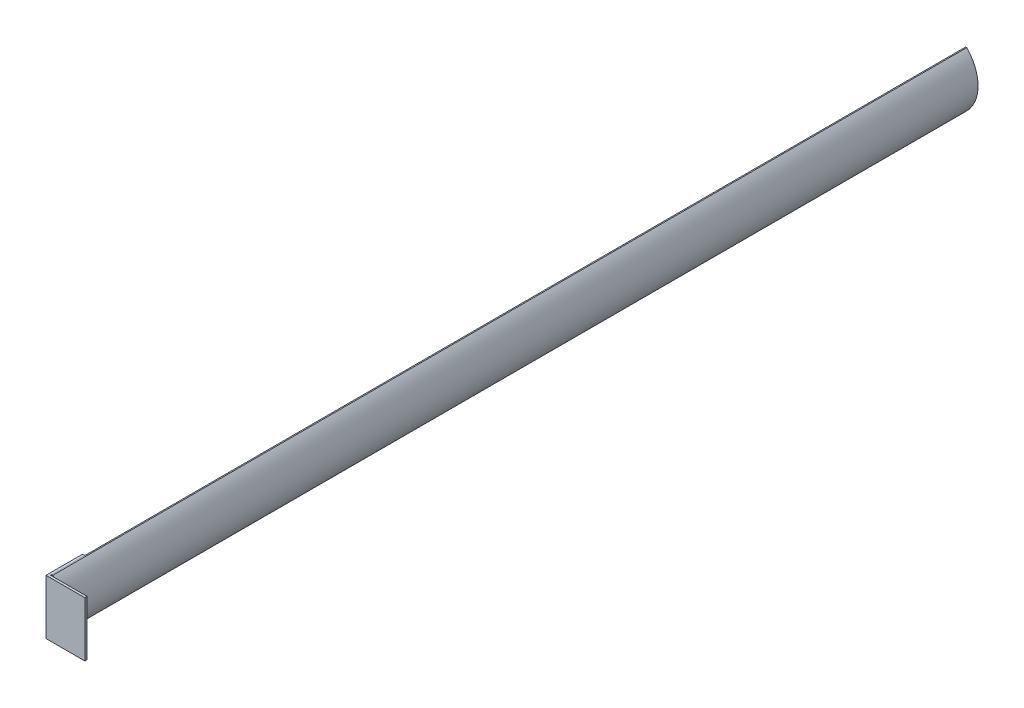
from build123d import *

# Parameters (mm, degrees)
SALIENTE_EXTRUIR1_DEPTH = 400
SALIENTE_EXTRUIR6_DEPTH = 24


with BuildPart() as part:
    # Croquis1 → Saliente-Extruir1 (new body)
    with BuildSketch(Plane.XY):
        with BuildLine():
            Line((0, 0), (-0.5, 0))
            ThreePointArc((-0.5, 0), (4.470562748, -12), (-0.5, -24))
            Line((-0.5, -24), (0, -24))
            ThreePointArc((0, -24), (4.970562748, -12), (0, 0))
        make_face()
    extrude(amount=SALIENTE_EXTRUIR1_DEPTH)


with BuildPart() as body_2:
    # Croquis2 → Saliente-Extruir6 (new body)
    with BuildSketch(Plane(origin=(0, 0, 0), x_dir=(1, 0, 0), z_dir=(0, 1, 0))):
        Polygon((-1.5, -385.5), (-0.5, -385.5), (-0.5, -400.5), (15.5, -400.5), (15.5, -401.5), (-1.5, -401.5), align=None)
    extrude(amount=-SALIENTE_EXTRUIR6_DEPTH)


solid = Compound([part.part, body_2.part])
